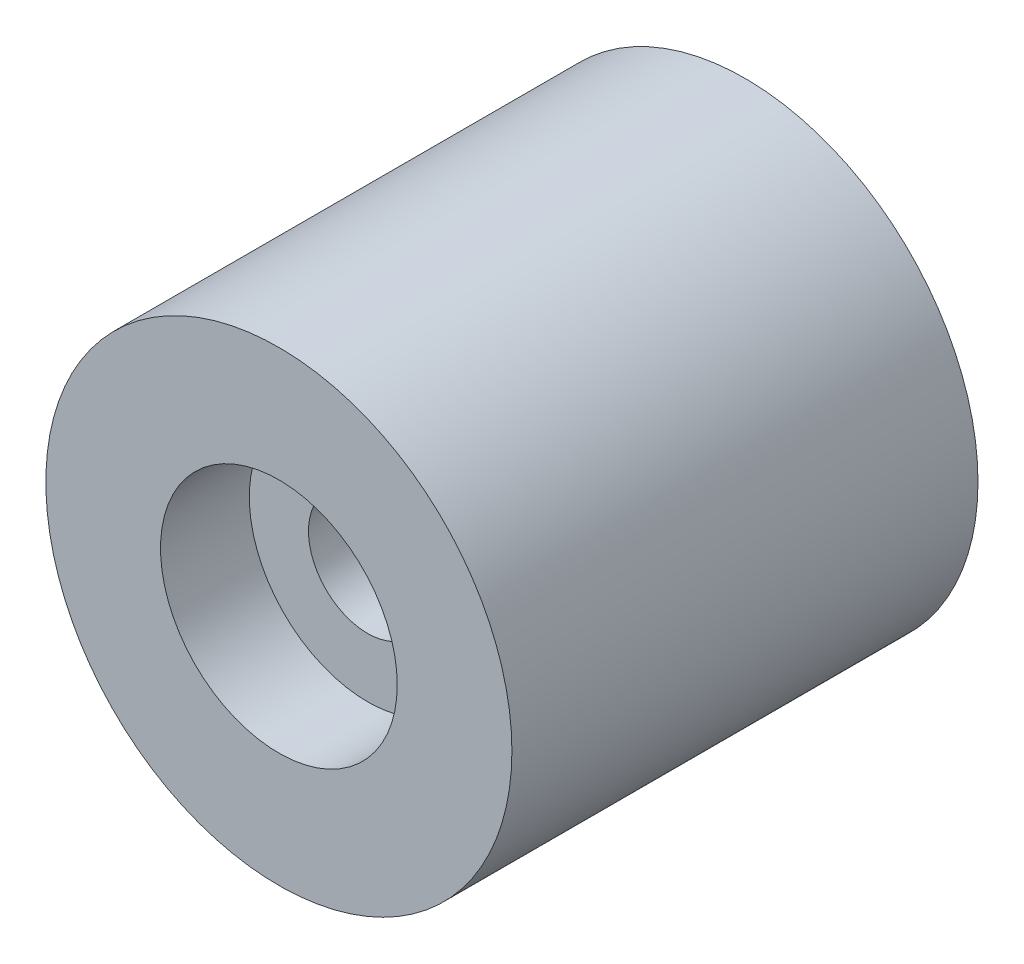
from build123d import *

# Parameters (mm, degrees)
SKETCH1_R           = 7.875
SKETCH1_R_2         = 2
BOSS_EXTRUDE1_DEPTH = 15.75
SKETCH2_R           = 4
CUT_EXTRUDE1_DEPTH  = 3


with BuildPart() as part:
    # Sketch1 → Boss-Extrude1 (new body)
    with BuildSketch(Plane(origin=(0, 0, 0), x_dir=(0, 1, 0), z_dir=(0, 0, 1))):
        with Locations(Location((0, 0, 0), (0, 0, 270))):
            Circle(SKETCH1_R)
        with Locations(Location((0, 0, 0), (0, 0, 270))):
            Circle(SKETCH1_R_2, mode=Mode.SUBTRACT)
    extrude(amount=BOSS_EXTRUDE1_DEPTH)

    # Sketch2 → Cut-Extrude1 (cut)
    with BuildSketch(Plane.XY.offset(15.75)):
        Circle(SKETCH2_R)
    extrude(amount=-CUT_EXTRUDE1_DEPTH, mode=Mode.SUBTRACT)


solid = part.part
